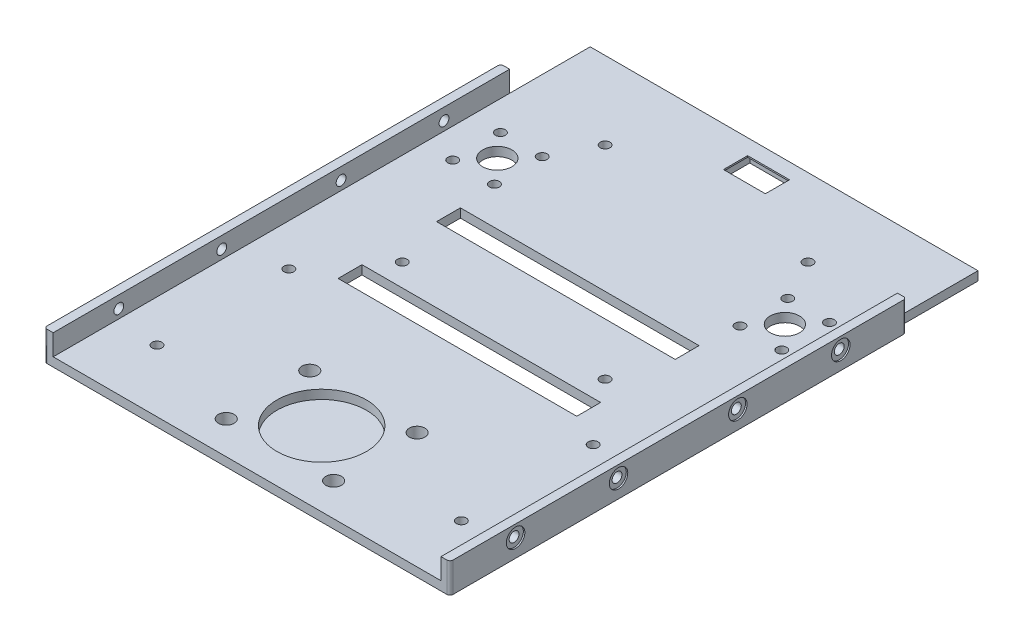
from build123d import *
from build123d.topology import SkipClean

# Parameters (mm, degrees)
SKETCH_1_W          = 130
SKETCH_1_H          = 180
SKETCH_1_R          = 1.65
SKETCH_1_R_2        = 4.9
SKETCH_1_R_3        = 2.625
SKETCH_1_R_4        = 15
SKETCH_1_W_2        = 80
SKETCH_1_H_2        = 4
EXTRUDE_1_DEPTH     = 3
SKETCH_3_R          = 1.65
CUT_EXTRUDE_2_DEPTH = 112.05854312
SKETCH_4_W          = 15
SKETCH_4_H          = 10.5
CUT_EXTRUDE_3_DEPTH = 2.51
SKETCH_5_W          = 14.05
SKETCH_5_H          = 8.1
CUT_EXTRUDE_4_DEPTH = 0.49
EXTRUDE_START       = 45
SKETCH_6_W          = 25
SKETCH_6_H          = 1
EXTRUDE_2_DEPTH     = 40
SKETCH_9_R          = 2.625
CUT_EXTRUDE_5_DEPTH = 1
EXTRUDE_START_2     = -3
EXTRUDE_3_DEPTH     = 10
SKETCH_11_R         = 1.65
CUT_EXTRUDE_6_DEPTH = 133
SKETCH_12_R         = 3.1
CUT_EXTRUDE_7_DEPTH = 0.5
SKETCH_13_W         = 80
SKETCH_13_H         = 8
CUT_EXTRUDE_8_DEPTH = 3


with BuildPart() as part:
    # 草图1 → 凸台-拉伸1 (new body)
    with BuildSketch(Plane(origin=(0, 0, 0), x_dir=(1, 0, 0), z_dir=(0, 1, 0))):
        Rectangle(SKETCH_1_W, SKETCH_1_H)
        with Locations(Location((41.15, 34.063716669, 0), (0, 0, 90))):
            Circle(SKETCH_1_R, mode=Mode.SUBTRACT)
        with Locations(Location((55.15, 34.063716669, 0), (0, 0, 90))):
            Circle(SKETCH_1_R, mode=Mode.SUBTRACT)
        with Locations(Location((48.2, 42.063716669, 0), (0, 0, 90))):
            Circle(SKETCH_1_R_2, mode=Mode.SUBTRACT)
        with Locations(Location((41.15, 50.063716669, 0), (0, 0, 90))):
            Circle(SKETCH_1_R, mode=Mode.SUBTRACT)
        with Locations(Location((55.15, 50.063716669, 0), (0, 0, 90))):
            Circle(SKETCH_1_R, mode=Mode.SUBTRACT)
        with Locations(Location((-18, -51, 0), (0, 0, 270))):
            Circle(SKETCH_1_R_3, mode=Mode.SUBTRACT)
        with Locations(Location((18, -51, 0), (0, 0, 270))):
            Circle(SKETCH_1_R_3, mode=Mode.SUBTRACT)
        with Locations(Location((18, -79, 0), (0, 0, 270))):
            Circle(SKETCH_1_R_3, mode=Mode.SUBTRACT)
        with Locations(Location((-18, -79, 0), (0, 0, 270))):
            Circle(SKETCH_1_R_3, mode=Mode.SUBTRACT)
        with Locations(Location((0, -65, 0), (0, 0, 270))):
            Circle(SKETCH_1_R_4, mode=Mode.SUBTRACT)
        with Locations(Location((-41.15, 34.063716669, 0), (0, 0, 270))):
            Circle(SKETCH_1_R, mode=Mode.SUBTRACT)
        with Locations(Location((-55.15, 34.063716669, 0), (0, 0, 270))):
            Circle(SKETCH_1_R, mode=Mode.SUBTRACT)
        with Locations(Location((-55.15, 50.063716669, 0), (0, 0, 270))):
            Circle(SKETCH_1_R, mode=Mode.SUBTRACT)
        with Locations(Location((-48.2, 42.063716669, 0), (0, 0, 270))):
            Circle(SKETCH_1_R_2, mode=Mode.SUBTRACT)
        with Locations(Location((-41.15, 50.063716669, 0), (0, 0, 270))):
            Circle(SKETCH_1_R, mode=Mode.SUBTRACT)
        with Locations((0, -15.5)):
            Rectangle(SKETCH_1_W_2, SKETCH_1_H_2, mode=Mode.SUBTRACT)
        with Locations((0, 17.5)):
            Rectangle(SKETCH_1_W_2, SKETCH_1_H_2, mode=Mode.SUBTRACT)
    extrude(amount=EXTRUDE_1_DEPTH)

    # 草图3 → 切除-拉伸2 (cut, through all)
    with BuildSketch(Plane(origin=(0, 0, 0), x_dir=(1, 0, 0), z_dir=(0, 1, 0))):
        with Locations(Location((-34, 64, 0), (0, 0, 270))):
            Circle(SKETCH_3_R)
        with Locations(Location((-34, -4, 0), (0, 0, 270))):
            Circle(SKETCH_3_R)
        with Locations(Location((34, -4, 0), (0, 0, 90))):
            Circle(SKETCH_3_R)
        with Locations(Location((34, 64, 0), (0, 0, 90))):
            Circle(SKETCH_3_R)
        with Locations(Location((-51, -25, 0), (0, 0, 270))):
            Circle(SKETCH_3_R)
        with Locations(Location((-51.004420949, -69.2, 0), (0, 0, 270))):
            Circle(SKETCH_3_R)
        with Locations(Location((51.004420949, -69.2, 0), (0, 0, 90))):
            Circle(SKETCH_3_R)
        with Locations(Location((51, -25, 0), (0, 0, 90))):
            Circle(SKETCH_3_R)
    extrude(amount=CUT_EXTRUDE_2_DEPTH, mode=Mode.SUBTRACT)

    # 草图4 → 切除-拉伸3 (cut)
    with BuildSketch(Plane.XZ):
        with Locations((0, -80.75)):
            Rectangle(SKETCH_4_W, SKETCH_4_H)
    extrude(amount=-CUT_EXTRUDE_3_DEPTH, mode=Mode.SUBTRACT)

    # 草图5 → 切除-拉伸4 (cut)
    with BuildSketch(Plane.XZ.offset(-2.51)):
        with Locations((0, -80.75)):
            Rectangle(SKETCH_5_W, SKETCH_5_H)
    extrude(amount=-CUT_EXTRUDE_4_DEPTH, mode=Mode.SUBTRACT)

    # 草图6 → 凸台-拉伸2 (add)
    with BuildSketch(Plane.XY.offset(EXTRUDE_START)):
        with Locations((-12.5, -0.5)):
            Rectangle(SKETCH_6_W, SKETCH_6_H)
        with Locations((12.5, -0.5)):
            Rectangle(SKETCH_6_W, SKETCH_6_H)
    extrude(amount=EXTRUDE_2_DEPTH)

    # 草图9 → 切除-拉伸5 (cut)
    with SkipClean():  # the faces are left unmerged after this step: merging them gives an invalid solid
        with BuildSketch(Plane.XZ.offset(1)):
            with Locations(Location((-18, 51, 0), (0, 0, 270))):
                Circle(SKETCH_9_R)
            with Locations(Location((18, 51, 0), (0, 0, 270))):
                Circle(SKETCH_9_R)
            with Locations(Location((-18, 79, 0), (0, 0, 270))):
                Circle(SKETCH_9_R)
            with Locations(Location((18, 79, 0), (0, 0, 270))):
                Circle(SKETCH_9_R)
        extrude(amount=-CUT_EXTRUDE_5_DEPTH, mode=Mode.SUBTRACT)

    # 草图10 → 凸台-拉伸3 (add)
    with SkipClean():  # the faces are left unmerged after this step: merging them gives an invalid solid
        with BuildSketch(Plane(origin=(0, 3, 0), x_dir=(1, 0, 0), z_dir=(0, 1, 0)).offset(EXTRUDE_START_2)):
            with BuildLine():
                Line((-65, 63), (-67, 63))
                ThreePointArc((-67, 63), (-67.707106781, 62.707106781), (-68, 62))
                Line((-68, 62), (-68, -89))
                ThreePointArc((-68, -89), (-67.707106781, -89.707106781), (-67, -90))
                Line((-67, -90), (-65, -90))
                Line((-65, -90), (-65, 63))
            make_face()
            with BuildLine():
                Line((65, -90), (65, 63))
                Line((65, 63), (67, 63))
                ThreePointArc((67, 63), (67.707106781, 62.707106781), (68, 62))
                Line((68, 62), (68, -89))
                ThreePointArc((68, -89), (67.707106781, -89.707106781), (67, -90))
                Line((67, -90), (65, -90))
            make_face()
        extrude(amount=EXTRUDE_3_DEPTH)

    # 草图11 → 切除-拉伸6 (cut)
    with SkipClean():  # the faces are left unmerged after this step: merging them gives an invalid solid
        with BuildSketch(Plane(origin=(68, 0, 0), x_dir=(0, 0, -1), z_dir=(1, 0, 0))):
            with Locations((-33.5, 6)):
                Circle(SKETCH_11_R)
            with Locations((-68, 6)):
                Circle(SKETCH_11_R)
            with Locations((6.5, 6)):
                Circle(SKETCH_11_R)
            with Locations((41, 6)):
                Circle(SKETCH_11_R)
        cut_extrude_6 = extrude(amount=-CUT_EXTRUDE_6_DEPTH, mode=Mode.SUBTRACT)

    # 镜向1: 切除-拉伸6 across plane
    with SkipClean():  # the faces are left unmerged after this step: merging them gives an invalid solid
        add(cut_extrude_6.mirror(Plane(origin=(0, 0, 0), x_dir=(0, 0, 1), z_dir=(1, 0, 0))), mode=Mode.SUBTRACT)

    # 草图12 → 切除-拉伸7 (cut)
    with SkipClean():  # the faces are left unmerged after this step: merging them gives an invalid solid
        with BuildSketch(Plane(origin=(68, 0, 0), x_dir=(0, 0, -1), z_dir=(1, 0, 0))):
            with Locations((-68, 6)):
                Circle(SKETCH_12_R)
            with Locations((-33.5, 6)):
                Circle(SKETCH_12_R)
            with Locations((6.5, 6)):
                Circle(SKETCH_12_R)
            with Locations((41, 6)):
                Circle(SKETCH_12_R)
        cut_extrude_7 = extrude(amount=-CUT_EXTRUDE_7_DEPTH, mode=Mode.SUBTRACT)

    # 镜向3: 切除-拉伸7 across plane
    with SkipClean():  # the faces are left unmerged after this step: merging them gives an invalid solid
        add(cut_extrude_7.mirror(Plane(origin=(0, 0, 0), x_dir=(0, 0, 1), z_dir=(1, 0, 0))), mode=Mode.SUBTRACT)

    # 草图13 → 切除-拉伸8 (cut)
    with SkipClean():  # the faces are left unmerged after this step: merging them gives an invalid solid
        with BuildSketch(Plane(origin=(0, 3, 0), x_dir=(1, 0, 0), z_dir=(0, 1, 0))):
            with Locations((0, -15.5)):
                Rectangle(SKETCH_13_W, SKETCH_13_H)
            with Locations((0, 17.5)):
                Rectangle(SKETCH_13_W, SKETCH_13_H)
        extrude(amount=-CUT_EXTRUDE_8_DEPTH, mode=Mode.SUBTRACT)


solid = part.part
